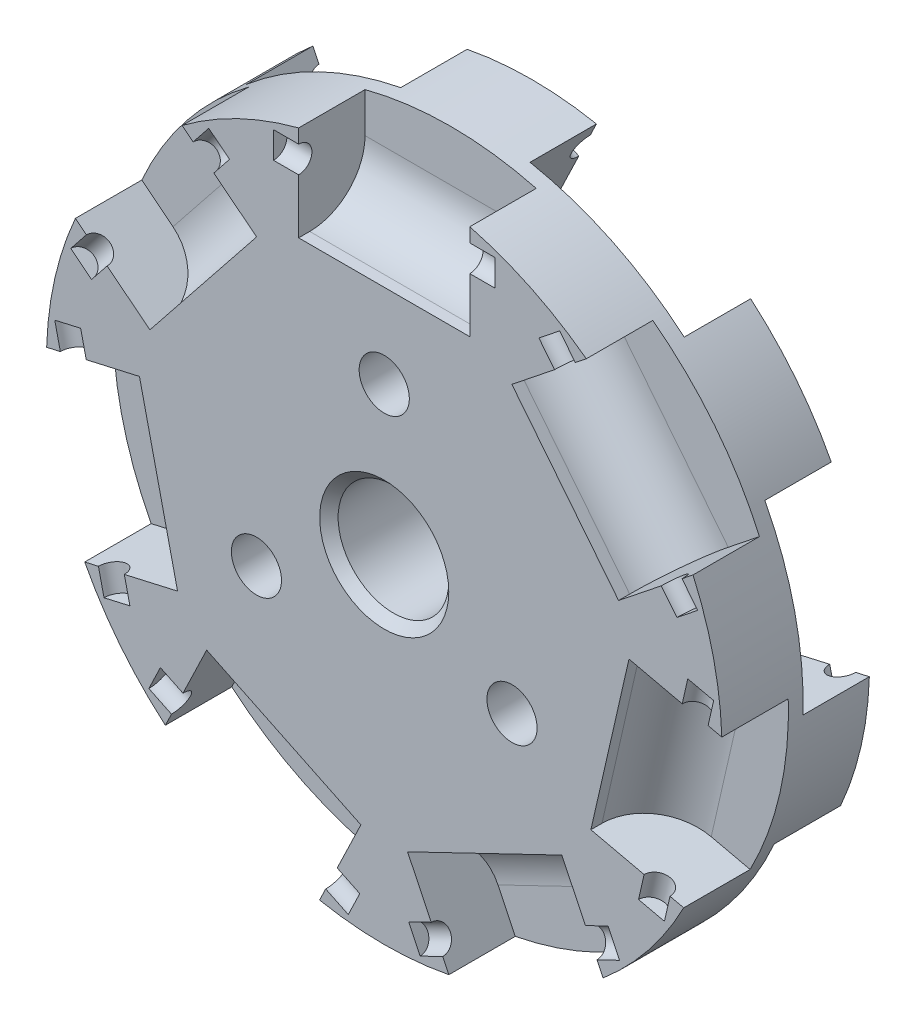
from build123d import *

# Parameters (mm, degrees)
SKETCH1_R           = 29.0703
BOSS_EXTRUDE2_DEPTH = 6.35
SKETCH2_W           = 14.732
SKETCH2_H           = 10.414
CUT_EXTRUDE2_DEPTH  = 5.715
CIRPATTERN1_COUNT   = 7
SKETCH4_R           = 1.143
CUT_EXTRUDE4_DEPTH  = 9.525
CIRPATTERN2_COUNT   = 7
SKETCH5_R           = 4.7625
CUT_EXTRUDE5_DEPTH  = 42.599124801
SKETCH6_R           = 2.159
CUT_EXTRUDE7_DEPTH  = 42.599124801
BOSS_EXTRUDE3_START = 6.35
SKETCH9_R           = 29.0703
SKETCH9_R_2         = 2.159
SKETCH9_R_3         = 4.7625
BOSS_EXTRUDE3_DEPTH = 6.35
CUT_EXTRUDE8_DEPTH  = 5.715
CIRPATTERN3_COUNT   = 7
SKETCH11_R          = 1.143
CUT_EXTRUDE9_DEPTH  = 9.525
CIRPATTERN4_COUNT   = 7
FILLET1_R           = 4.7625
CHAMFER1_SIZE       = 0.79375


with BuildPart() as part:
    # Sketch1 → Boss-Extrude2 (new body)
    with BuildSketch(Plane.XY):
        Circle(SKETCH1_R)
    extrude(amount=-BOSS_EXTRUDE2_DEPTH)

    # Sketch2 → Cut-Extrude2 (cut)
    with BuildSketch(Plane.XY):
        with Locations((0, 25.1333)):
            Rectangle(SKETCH2_W, SKETCH2_H)
    cut_extrude2 = extrude(amount=-CUT_EXTRUDE2_DEPTH, mode=Mode.SUBTRACT)

    # CirPattern1: Cut-Extrude2 ×7 about axis
    cirpattern1_axis = Axis((0, 0, 0), (0, 0, 1))
    for i in range(1, CIRPATTERN1_COUNT):
        add(cut_extrude2.rotate(cirpattern1_axis, i * 360 / CIRPATTERN1_COUNT), mode=Mode.SUBTRACT)

    # Sketch4 → Cut-Extrude4 (cut, symmetric)
    with BuildSketch(Plane(origin=(0, 0, 0), x_dir=(0, 0, -1), z_dir=(1, 0, 0))):
        with Locations((0, 25.7683)):
            Circle(SKETCH4_R)
    cut_extrude4 = extrude(amount=CUT_EXTRUDE4_DEPTH, both=True, mode=Mode.SUBTRACT)

    # CirPattern2: Cut-Extrude4 ×7 about axis
    cirpattern2_axis = Axis((0, 0, 0), (0, 0, 1))
    for i in range(1, CIRPATTERN2_COUNT):
        add(cut_extrude4.rotate(cirpattern2_axis, i * 360 / CIRPATTERN2_COUNT), mode=Mode.SUBTRACT)

    # Sketch5 → Cut-Extrude5 (cut, through all)
    with BuildSketch(Plane.XY):
        Circle(SKETCH5_R)
    extrude(amount=-CUT_EXTRUDE5_DEPTH, mode=Mode.SUBTRACT)

    # Sketch6 → Cut-Extrude7 (cut, through all)
    with BuildSketch(Plane(origin=(0, 0, -6.35), x_dir=(-1, 0, 0), z_dir=(0, 0, -1))):
        with Locations((0, 12.7)):
            Circle(SKETCH6_R)
        with Locations((10.998522628, -6.35)):
            Circle(SKETCH6_R)
        with Locations((-10.998522628, -6.35)):
            Circle(SKETCH6_R)
    extrude(amount=-CUT_EXTRUDE7_DEPTH, mode=Mode.SUBTRACT)

    # Sketch9 → Boss-Extrude3 (add)
    with BuildSketch(Plane(origin=(0, 0, -6.35), x_dir=(-1, 0, 0), z_dir=(0, 0, -1)).offset(BOSS_EXTRUDE3_START)):
        with Locations(Location((0, 0, 0), (0, 0, 178.179188094))):
            Circle(SKETCH9_R)
        with Locations((0, 12.7)):
            Circle(SKETCH9_R_2, mode=Mode.SUBTRACT)
        with Locations((10.998522628, -6.35)):
            Circle(SKETCH9_R_2, mode=Mode.SUBTRACT)
        with Locations((-10.998522628, -6.35)):
            Circle(SKETCH9_R_2, mode=Mode.SUBTRACT)
        with Locations(Location((0, 0, 0), (0, 0, 180))):
            Circle(SKETCH9_R_3, mode=Mode.SUBTRACT)
    extrude(amount=-BOSS_EXTRUDE3_DEPTH)

    # Sketch10 → Cut-Extrude8 (cut)
    with BuildSketch(Plane(origin=(0, 0, -12.7), x_dir=(-1, 0, 0), z_dir=(0, 0, -1))):
        Polygon((-2.009055407, 21.148973594), (-15.282160644, 14.757064537), (-19.800579114, 24.139776859), (-6.527473878, 30.531685916), align=None)
    cut_extrude8 = extrude(amount=-CUT_EXTRUDE8_DEPTH, mode=Mode.SUBTRACT)

    # CirPattern3: Cut-Extrude8 ×7 about axis
    cirpattern3_axis = Axis((0, 0, 0), (0, 0, 1))
    for i in range(1, CIRPATTERN3_COUNT):
        add(cut_extrude8.rotate(cirpattern3_axis, i * 360 / CIRPATTERN3_COUNT), mode=Mode.SUBTRACT)

    # Sketch11 → Cut-Extrude9 (cut, symmetric)
    with BuildSketch(Plane(origin=(0, 0, 0), x_dir=(0, 0, -1), z_dir=(-0.900971031519736, 0.4338792462912495, 0))):
        with Locations((12.7, -25.7683)):
            Circle(SKETCH11_R)
    cut_extrude9 = extrude(amount=CUT_EXTRUDE9_DEPTH, both=True, mode=Mode.SUBTRACT)

    # CirPattern4: Cut-Extrude9 ×7 about axis
    cirpattern4_axis = Axis((0, 0, 0), (0, 0, 1))
    for i in range(1, CIRPATTERN4_COUNT):
        add(cut_extrude9.rotate(cirpattern4_axis, i * 360 / CIRPATTERN4_COUNT), mode=Mode.SUBTRACT)

    # Fillet1
    fillet1_edges = [part.edges().sort_by_distance(p)[0] for p in [
        (-15.579008669, 12.423844839, -5.715),
        (0, 19.9263, -5.715),
        (8.645608025, 17.953019065, -6.985),
        (-8.645787076, 17.952932839, -6.985),
        (-19.426728167, 4.433922012, -6.985),
        (-15.578946715, -12.423922526, -6.985),
        (9.9366e-05, -19.9263, -6.985),
        (15.579070622, -12.423767151, -6.985),
        (19.426683945, 4.434115761, -6.985),
        (8.645697551, -17.952975952, -5.715),
        (19.426706057, -4.434018886, -5.715),
        (-19.426706057, -4.434018886, -5.715),
        (-8.645697551, -17.952975952, -5.715),
        (15.579008669, 12.423844839, -5.715),
    ]]
    fillet(fillet1_edges, radius=FILLET1_R)

    # Chamfer1
    chamfer1_edges = [part.edges().sort_by_distance(p)[0] for p in [
        (-4.7625, 0, 0),
        (-4.7625, 0, -12.7),
    ]]
    chamfer(chamfer1_edges, length=CHAMFER1_SIZE)


solid = part.part
